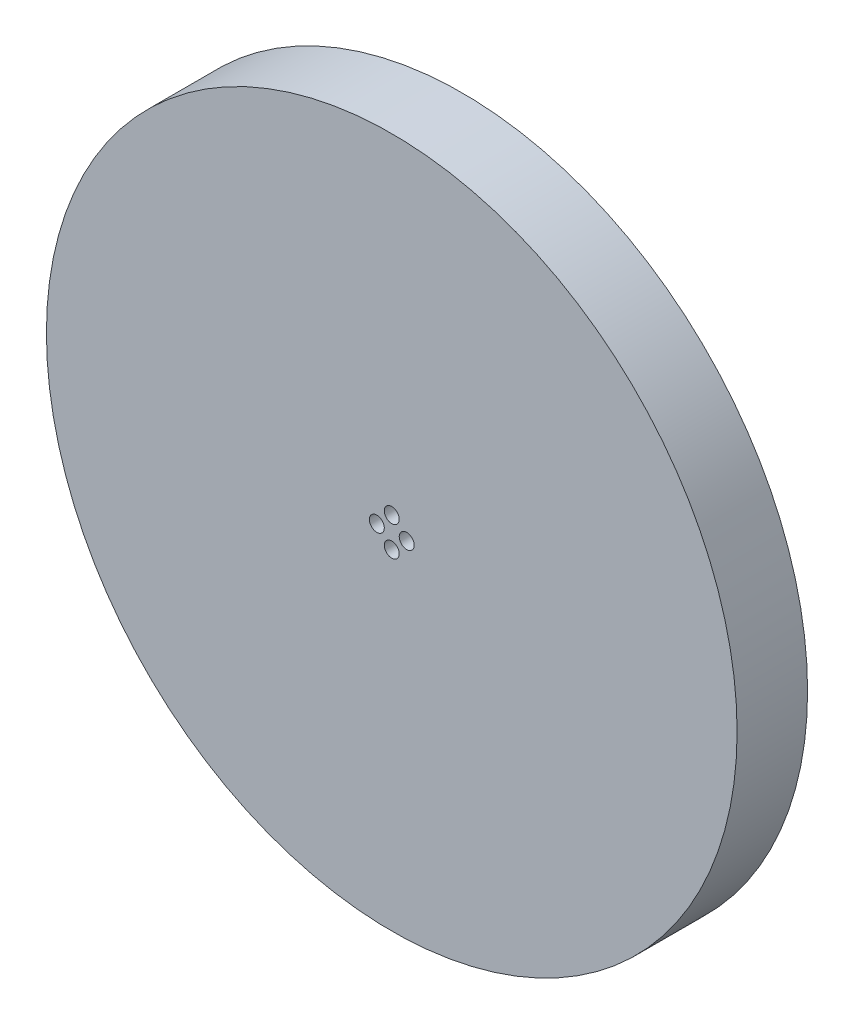
from build123d import *

# Parameters (mm, degrees)
ESQUISSE1_R                  = 24.5
BOSS_EXTRU_1_DEPTH           = 5
ESQUISSE2_R                  = 0.53
ENL_V_MAT_EXTRU_1_DEPTH      = 5
R_P_TITION_CIRCULAIRE1_COUNT = 4


with BuildPart() as part:
    # Esquisse1 → Boss.-Extru.1 (new body)
    with BuildSketch(Plane.XY):
        Circle(ESQUISSE1_R)
    extrude(amount=BOSS_EXTRU_1_DEPTH)

    # Esquisse2 → Enlèv. mat.-Extru.1 (cut)
    with BuildSketch(Plane.XY.offset(5)):
        with Locations((0, 1.06)):
            Circle(ESQUISSE2_R)
    enl_v_mat_extru_1 = extrude(amount=-ENL_V_MAT_EXTRU_1_DEPTH, mode=Mode.SUBTRACT)

    # Répétition circulaire1: Enlèv. mat.-Extru.1 ×4 about axis
    r_p_tition_circulaire1_axis = Axis((0, 0, 0), (0, 0, 1))
    for i in range(1, R_P_TITION_CIRCULAIRE1_COUNT):
        add(enl_v_mat_extru_1.rotate(r_p_tition_circulaire1_axis, i * 360 / R_P_TITION_CIRCULAIRE1_COUNT), mode=Mode.SUBTRACT)


solid = part.part
